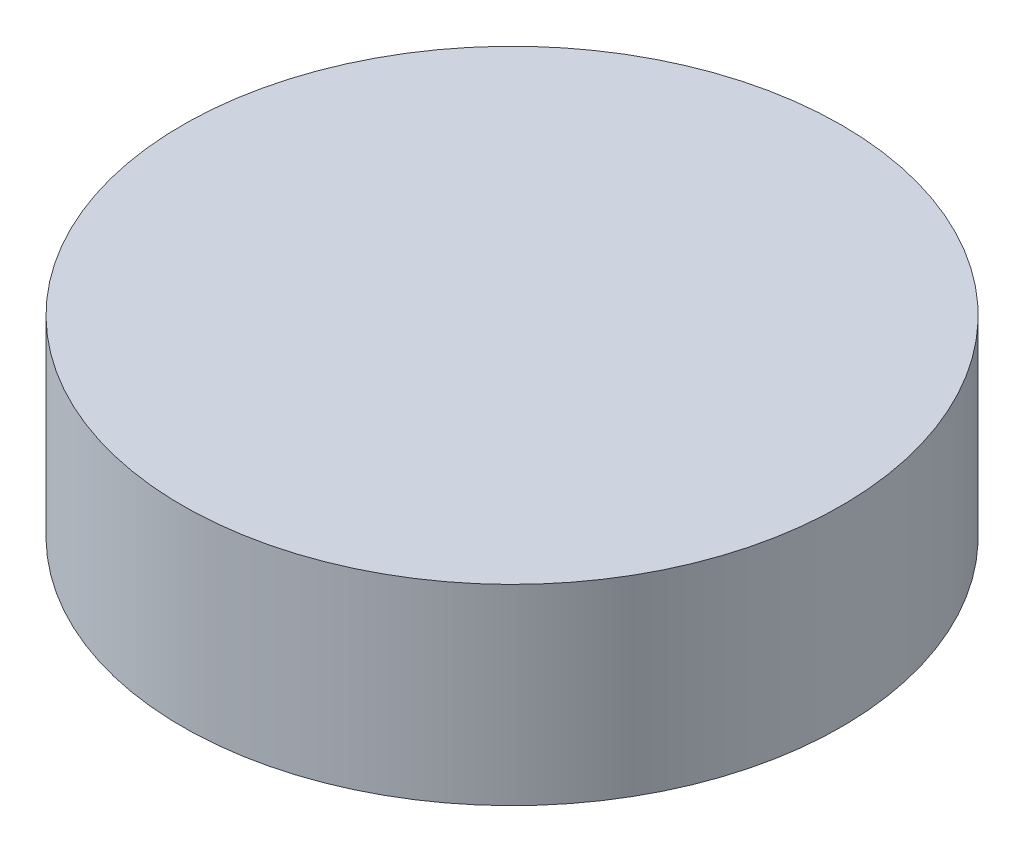
from build123d import *

# Parameters (mm, degrees)
SKETCH2_W           = 81.026
SKETCH2_H           = 1.5875
BOSS_EXTRUDE1_DEPTH = 6.35


with BuildPart() as part:
    # Sketch1 → Revolve1 (revolve)
    with BuildSketch(Plane.XY, mode=Mode.PRIVATE) as revolve1_sk:
        Polygon((0, 0), (43.688, 0), (43.688, -25.4), (40.513, -25.4), (40.513, -3.175), (0, -3.175), align=None)
    revolve(revolve1_sk.sketch.rotate(Axis((0, -3.175, 0), (0, 1, 0)), 90), axis=Axis((0, -3.175, 0), (0, 1, 0)))

    # Sketch2 → Boss-Extrude1 (add)
    with BuildSketch(Plane.XZ.offset(3.175)):
        Rectangle(SKETCH2_W, SKETCH2_H)
    extrude(amount=BOSS_EXTRUDE1_DEPTH)


solid = part.part
